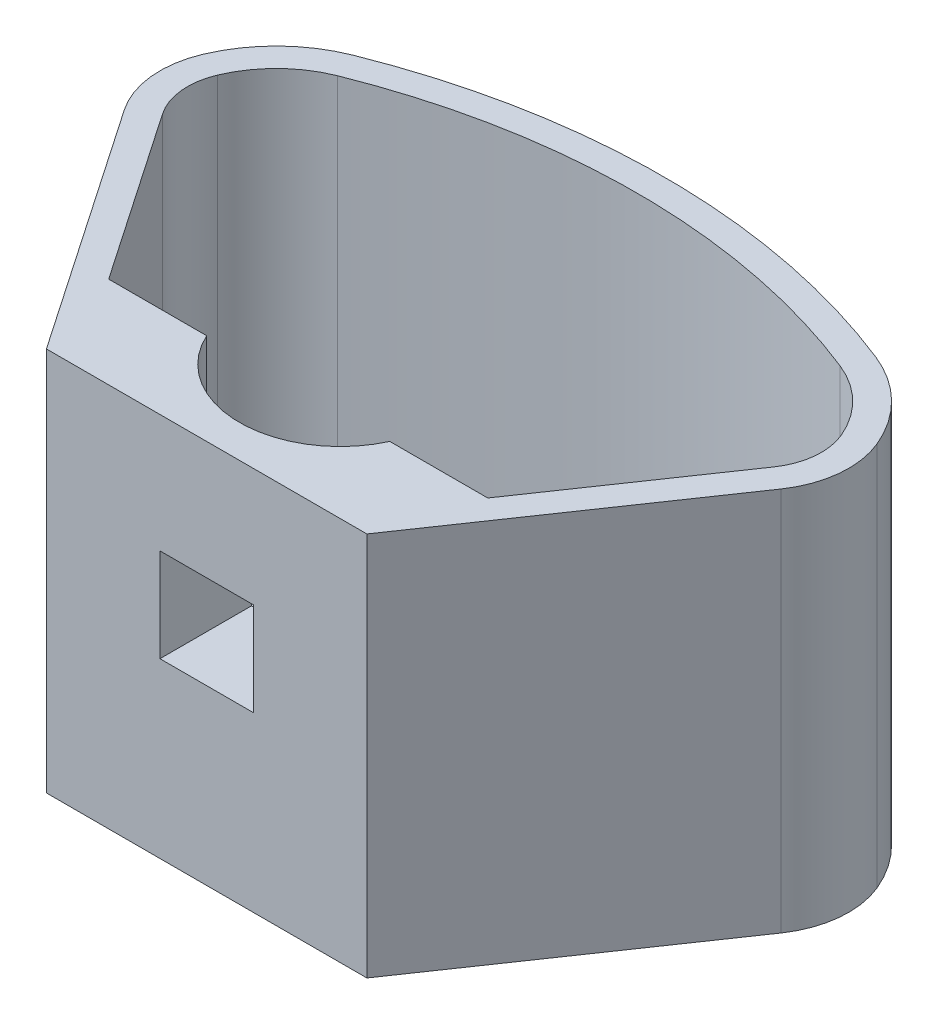
from build123d import *

# Parameters (mm, degrees)
BOSS_EXTRUDE1_DEPTH = 42
FILLET3_R           = 15
FILLET4_R           = 10
SHELL1_T            = -3
BOSS_EXTRUDE2_DEPTH = 39
CUT_EXTRUDE1_REACH  = 77.357
SKETCH4_W           = 10.2
SKETCH4_H           = 10.2
CUT_EXTRUDE2_DEPTH  = 10


with BuildPart() as part:
    # Sketch1 → Boss-Extrude1 (new body)
    with BuildSketch(Plane(origin=(0, 0, 0), x_dir=(1, 0, 0), z_dir=(0, 1, 0))):
        with BuildLine():
            Line((17.5, 0), (-17.5, 0))
            Line((-17.5, 0), (-38, 30))
            Line((-38, 30), (-38, 40))
            ThreePointArc((-38, 40), (0, 50), (38, 40))
            Line((38, 40), (38, 30))
            Line((38, 30), (17.5, 0))
        make_face()
    extrude(amount=BOSS_EXTRUDE1_DEPTH)

    # Fillet3
    fillet3_edges = [part.edges().sort_by_distance(p)[0] for p in [
        (-38, 21, -40),
        (38, 21, -40),
    ]]
    fillet(fillet3_edges, radius=FILLET3_R)

    # Fillet4
    fillet4_edges = [part.edges().sort_by_distance(p)[0] for p in [
        (38, 21, -30),
        (-38, 21, -30),
    ]]
    fillet(fillet4_edges, radius=FILLET4_R)

    # Shell1
    shell1_openings = [part.faces().sort_by_distance(p)[0] for p in [
        (0, 42, -26.142046548),
    ]]
    offset(amount=SHELL1_T, openings=shell1_openings)

    # Sketch3 → Boss-Extrude2 (add)
    with BuildSketch(Plane(origin=(0, 42, 0), x_dir=(1, 0, 0), z_dir=(0, 1, 0))):
        Polygon((-20.699808874, 10), (20.699808874, 10), (15.91647554, 3), (-15.91647554, 3), align=None)
    extrude(amount=-BOSS_EXTRUDE2_DEPTH)

    # Sketch4 → Cut-Extrude1 (cut, up to next)
    with BuildSketch(Plane.XY, mode=Mode.PRIVATE) as cut_extrude1_sk1:
        with Locations((0, 24)):
            Rectangle(SKETCH4_W, SKETCH4_H)
    cut_extrude1_tool1 = extrude(cut_extrude1_sk1.sketch, amount=-CUT_EXTRUDE1_REACH, mode=Mode.PRIVATE) & part.part
    add(cut_extrude1_tool1.solids().sort_by_distance((0, 24, 0))[0], mode=Mode.SUBTRACT)

    # Sketch5 → Cut-Extrude2 (cut)
    with BuildSketch(Plane(origin=(0, 42, 0), x_dir=(1, 0, 0), z_dir=(0, 1, 0))):
        with BuildLine():
            Line((-10, 10), (10, 10))
            ThreePointArc((10, 10), (0, 3.582575695), (-10, 10))
        make_face()
    extrude(amount=-CUT_EXTRUDE2_DEPTH, mode=Mode.SUBTRACT)


solid = part.part
